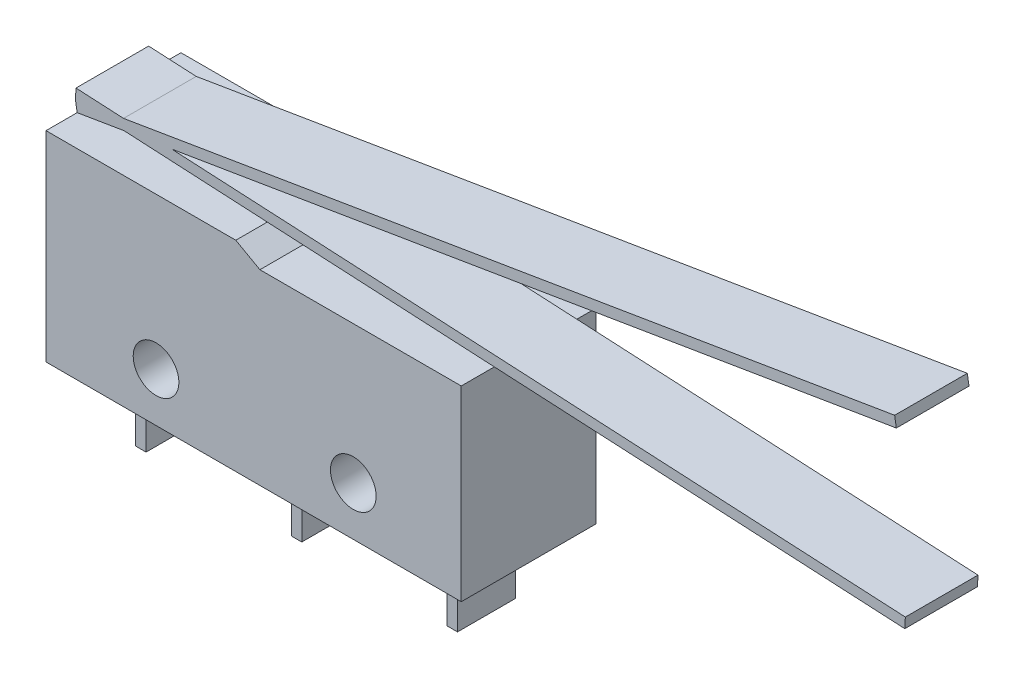
from build123d import *

# Parameters (mm, degrees)
ESQUISSE1_R      = 1.1
EXTRUSION1_DEPTH = 6.5
EXTRUSION2_START = -1.5
EXTRUSION2_DEPTH = 3.5
EXTRUSION3_START = -1.5
EXTRUSION3_DEPTH = 3.5
ESQUISSE4_W      = 0.5
ESQUISSE4_H      = 2.8
EXTRUSION4_DEPTH = 3.2


with BuildPart() as part:
    # Esquisse1 → Extrusion1 (new body)
    with BuildSketch(Plane.XY):
        Polygon((0, 0), (20, 0), (20, 9), (10.302547929, 9), (9.142677069, 9.65), (0, 9.65), align=None)
        with Locations(Location((14.8, 2.35, 0), (0, 0, 180))):
            Circle(ESQUISSE1_R, mode=Mode.SUBTRACT)
        with Locations(Location((5.3, 2.35, 0), (0, 0, 180))):
            Circle(ESQUISSE1_R, mode=Mode.SUBTRACT)
    extrude(amount=EXTRUSION1_DEPTH)

    # Esquisse4 → Extrusion4 (add)
    with BuildSketch(Plane.XZ):
        with Locations((2.72, 3.25)):
            Rectangle(ESQUISSE4_W, ESQUISSE4_H)
        with Locations((10.22, 3.25)):
            Rectangle(ESQUISSE4_W, ESQUISSE4_H)
        with Locations((17.72, 3.25)):
            Rectangle(ESQUISSE4_W, ESQUISSE4_H)
    extrude(amount=EXTRUSION4_DEPTH)


with BuildPart() as body_2:
    # Esquisse2 → Extrusion2 (new body)
    with BuildSketch(Plane.XY.offset(6.5).offset(EXTRUSION2_START)):
        Polygon((0, 9.65), (39.456397781, 16.22211337), (39.374246364, 16.715318343), (-0.082151417, 10.143204972), align=None)
    extrude(amount=-EXTRUSION2_DEPTH)

    # Esquisse3 → Extrusion3 (add)
    with BuildSketch(Plane.XY.offset(6.5).offset(EXTRUSION3_START)):
        Polygon((-0.055983439, 10.649314767), (39.889197951, 8.555876518), (39.863029973, 8.05656175), (-0.082151417, 10.15), align=None)
    extrude(amount=-EXTRUSION3_DEPTH)


solid = Compound([part.part, body_2.part])
